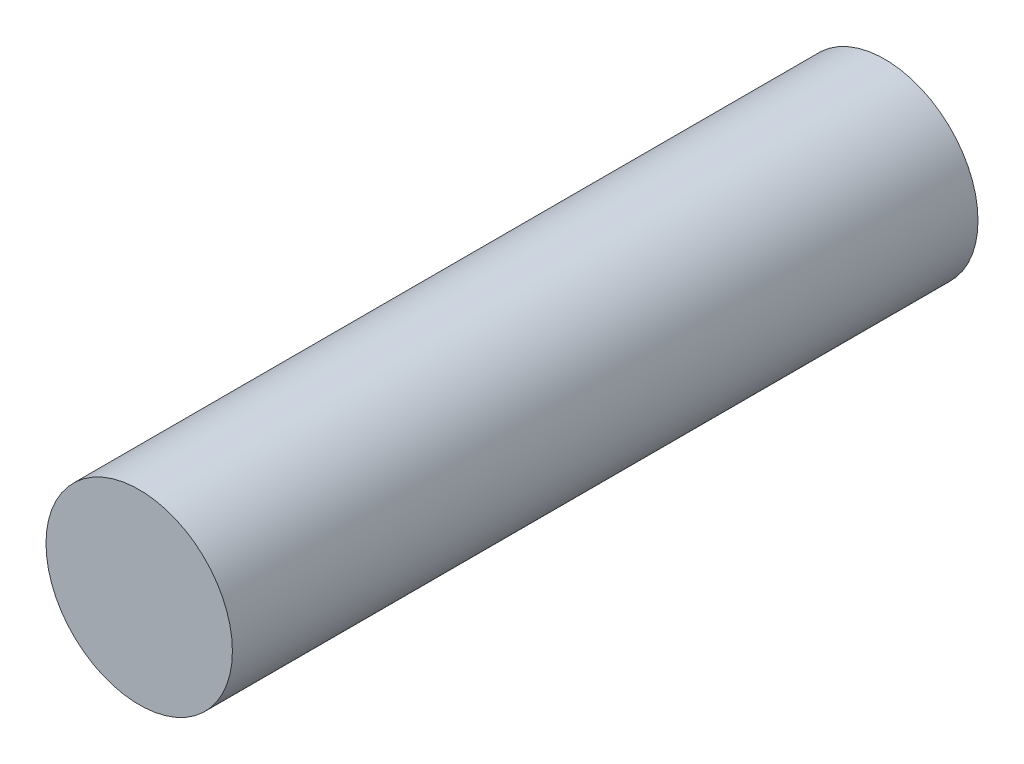
from build123d import *

# Parameters (mm, degrees)
SKETCH1_R           = 38.1
BOSS_EXTRUDE1_DEPTH = 304.8


with BuildPart() as part:
    # Sketch1 → Boss-Extrude1 (new body)
    with BuildSketch(Plane.XY):
        with Locations(Location((0, 0, 0), (0, 0, 180))):
            Circle(SKETCH1_R)
    extrude(amount=BOSS_EXTRUDE1_DEPTH)


solid = part.part
